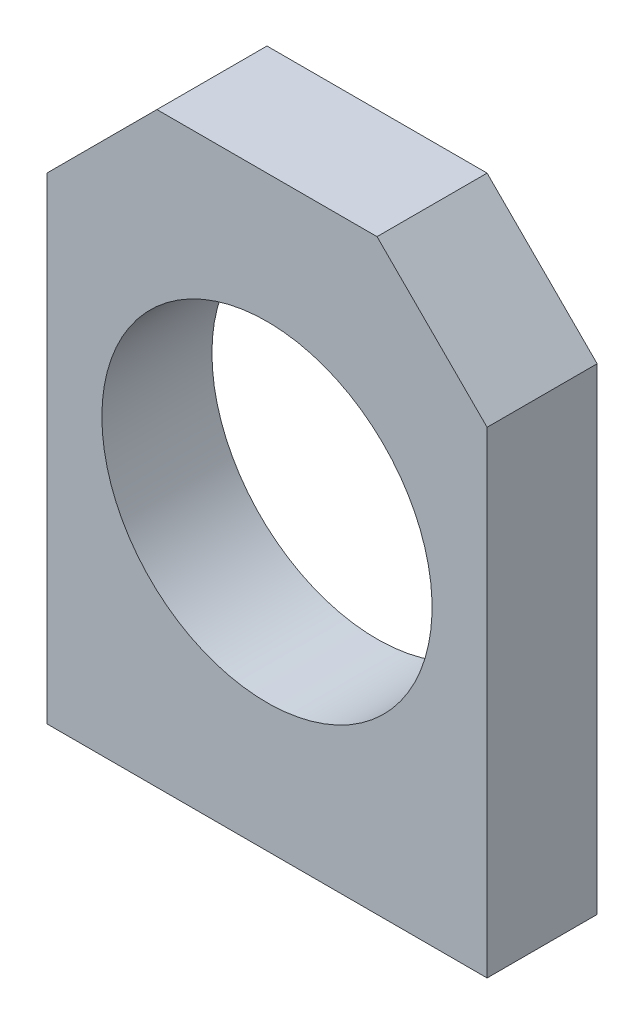
from build123d import *

# Parameters (mm, degrees)
SKETCH1_W           = 38.1
SKETCH1_H           = 9.525
BOSS_EXTRUDE1_DEPTH = 25.4
SKETCH3_R           = 14.2875
CUT_EXTRUDE1_DEPTH  = 34.147973166
CUT_EXTRUDE2_DEPTH  = 34.147973166


with BuildPart() as part:
    # Sketch1 → Boss-Extrude1 (new, symmetric)
    with BuildSketch(Plane(origin=(0, 0, 0), x_dir=(1, 0, 0), z_dir=(0, 1, 0))):
        with Locations((0, -4.7625)):
            Rectangle(SKETCH1_W, SKETCH1_H)
    extrude(amount=BOSS_EXTRUDE1_DEPTH, both=True)

    # Sketch3 → Cut-Extrude1 (cut, through all)
    with BuildSketch(Plane(origin=(0, 0, 0), x_dir=(-1, 0, 0), z_dir=(0, 0, -1))):
        Circle(SKETCH3_R)
    extrude(amount=-CUT_EXTRUDE1_DEPTH, mode=Mode.SUBTRACT)

    # Sketch4 → Cut-Extrude2 (cut, through all)
    with BuildSketch(Plane(origin=(0, 0, 0), x_dir=(-1, 0, 0), z_dir=(0, 0, -1))):
        Polygon((-9.525, 25.4), (-19.05, 15.875), (-19.05, 25.4), align=None)
        Polygon((9.525, 25.4), (19.05, 25.4), (19.05, 15.875), align=None)
    extrude(amount=-CUT_EXTRUDE2_DEPTH, mode=Mode.SUBTRACT)


solid = part.part
